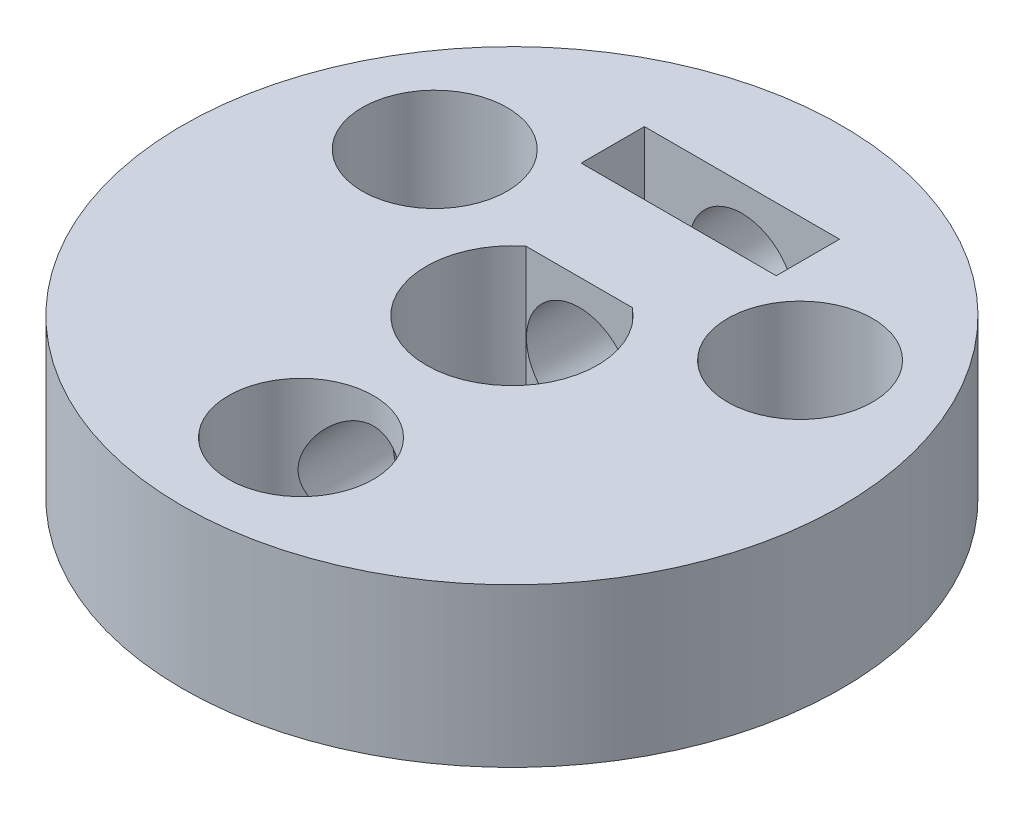
from build123d import *

# Parameters (mm, degrees)
SKETCH1_R                      = 12.5
BOSS_EXTRUDE1_DEPTH            = 6
CUT_EXTRUDE1_REACH             = 20.668
CUT_EXTRUDE2_REACH             = 20.668
SKETCH3_R                      = 2.75
CUT_EXTRUDE3_REACH             = 22.463
SKETCH4_R                      = 2
CUT_EXTRUDE3_DIRECTION_2_REACH = 22.463
CUT_EXTRUDE4_REACH             = 20.668
SKETCH5_W                      = 7.4
SKETCH5_H                      = 2.4


with BuildPart() as part:
    # Sketch1 → Boss-Extrude1 (new body)
    with BuildSketch(Plane(origin=(0, 0, 0), x_dir=(1, 0, 0), z_dir=(0, 1, 0))):
        with Locations(Location((0, 0, 0), (0, 0, 270))):
            Circle(SKETCH1_R)
    extrude(amount=BOSS_EXTRUDE1_DEPTH)

    # Sketch2 → Cut-Extrude1 (cut, up to next)
    with BuildSketch(Plane(origin=(0, 6, 0), x_dir=(1, 0, 0), z_dir=(0, 1, 0)), mode=Mode.PRIVATE) as cut_extrude1_sk1:
        with BuildLine():
            Line((2.014944168, 2.55), (-2.014944168, 2.55))
            ThreePointArc((-2.014944168, 2.55), (-1.416674178, -2.924984491), (3.25, 0))
            ThreePointArc((3.25, 0), (2.924984491, 1.416674178), (2.014944168, 2.55))
        make_face()
    cut_extrude1_tool1 = extrude(cut_extrude1_sk1.sketch, amount=-CUT_EXTRUDE1_REACH, mode=Mode.PRIVATE) & part.part
    add(cut_extrude1_tool1.solids().sort_by_distance((0, 6, 0.174477))[0], mode=Mode.SUBTRACT)

    # Sketch3 → Cut-Extrude2 (cut, up to next)
    with BuildSketch(Plane(origin=(0, 6, 0), x_dir=(1, 0, 0), z_dir=(0, 1, 0)), mode=Mode.PRIVATE) as cut_extrude2_sk1:
        with Locations(Location((0, -8, 0), (0, 0, 270))):
            Circle(SKETCH3_R)
    cut_extrude2_tool1 = extrude(cut_extrude2_sk1.sketch, amount=-CUT_EXTRUDE2_REACH, mode=Mode.PRIVATE) & part.part
    # Sketch3 → Cut-Extrude2 (cut, up to next)
    with BuildSketch(Plane(origin=(0, 6, 0), x_dir=(1, 0, 0), z_dir=(0, 1, 0)), mode=Mode.PRIVATE) as cut_extrude2_sk2:
        with Locations(Location((-6.92820323, 4, 0), (0, 0, 270))):
            Circle(SKETCH3_R)
    cut_extrude2_tool2 = extrude(cut_extrude2_sk2.sketch, amount=-CUT_EXTRUDE2_REACH, mode=Mode.PRIVATE) & part.part
    # Sketch3 → Cut-Extrude2 (cut, up to next)
    with BuildSketch(Plane(origin=(0, 6, 0), x_dir=(1, 0, 0), z_dir=(0, 1, 0)), mode=Mode.PRIVATE) as cut_extrude2_sk3:
        with Locations(Location((6.92820323, 4, 0), (0, 0, 270))):
            Circle(SKETCH3_R)
    cut_extrude2_tool3 = extrude(cut_extrude2_sk3.sketch, amount=-CUT_EXTRUDE2_REACH, mode=Mode.PRIVATE) & part.part
    add(cut_extrude2_tool1.solids().sort_by_distance((0, 6, 8))[0], mode=Mode.SUBTRACT)
    add(cut_extrude2_tool2.solids().sort_by_distance((-6.928203, 6, -4))[0], mode=Mode.SUBTRACT)
    add(cut_extrude2_tool3.solids().sort_by_distance((6.928203, 6, -4))[0], mode=Mode.SUBTRACT)

    # Sketch4 → Cut-Extrude3 (cut, up to next)
    with BuildSketch(Plane.XY.offset(-2.55), mode=Mode.PRIVATE) as cut_extrude3_sk1:
        with Locations(Location((0, 3, 0), (0, 0, 180))):
            Circle(SKETCH4_R)
    cut_extrude3_tool1 = extrude(cut_extrude3_sk1.sketch, amount=-CUT_EXTRUDE3_REACH, mode=Mode.PRIVATE) & part.part
    add(cut_extrude3_tool1.solids().sort_by_distance((0, 3, -2.55))[0], mode=Mode.SUBTRACT)

    # Sketch4 → Cut-Extrude3 direction 2 (cut, up to next)
    with BuildSketch(Plane.XY.offset(-2.55), mode=Mode.PRIVATE) as cut_extrude3_direction_2_sk1:
        with Locations(Location((0, 3, 0), (0, 0, 180))):
            Circle(SKETCH4_R)
    cut_extrude3_direction_2_tool1 = extrude(cut_extrude3_direction_2_sk1.sketch, amount=CUT_EXTRUDE3_DIRECTION_2_REACH, mode=Mode.PRIVATE) & part.part
    add(cut_extrude3_direction_2_tool1.solids().sort_by_distance((0, 3, -2.55))[0], mode=Mode.SUBTRACT)

    # Sketch5 → Cut-Extrude4 (cut, up to next)
    with BuildSketch(Plane(origin=(0, 6, 0), x_dir=(1, 0, 0), z_dir=(0, 1, 0)), mode=Mode.PRIVATE) as cut_extrude4_sk1:
        with Locations((0, 7.525)):
            Rectangle(SKETCH5_W, SKETCH5_H)
    cut_extrude4_tool1 = extrude(cut_extrude4_sk1.sketch, amount=-CUT_EXTRUDE4_REACH, mode=Mode.PRIVATE) & part.part
    add(cut_extrude4_tool1.solids().sort_by_distance((0, 6, -7.525))[0], mode=Mode.SUBTRACT)


solid = part.part
